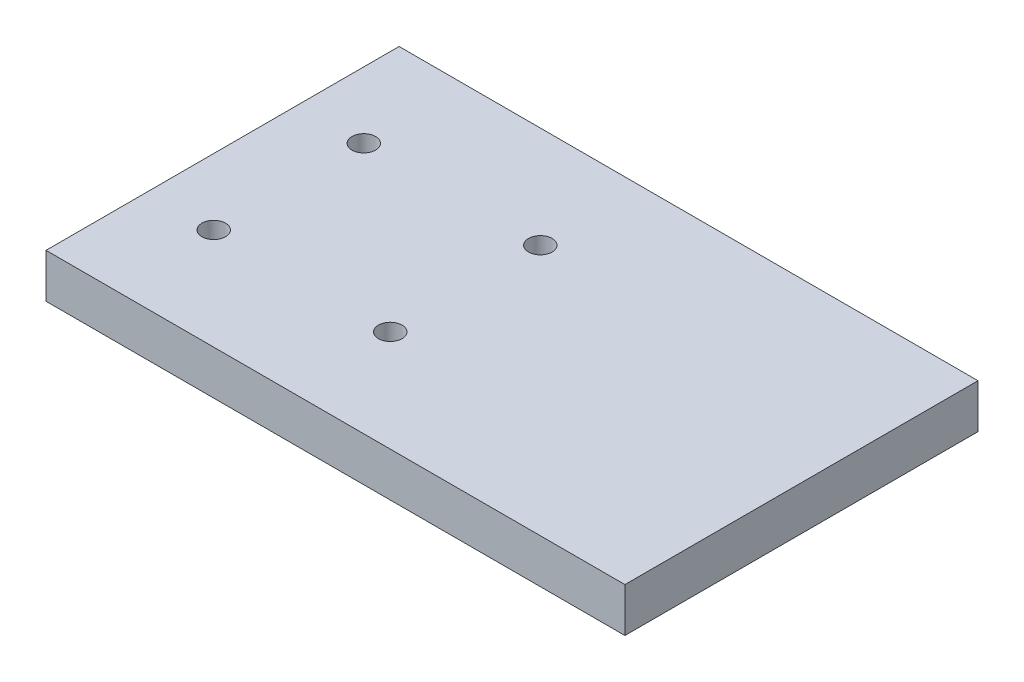
from build123d import *

# Parameters (mm, degrees)
SKETCH1_R           = 1.70053
BOSS_EXTRUDE1_DEPTH = 6.35


with BuildPart() as part:
    # Sketch1 → Boss-Extrude1 (new body)
    with BuildSketch(Plane(origin=(0, 0, 0), x_dir=(1, 0, 0), z_dir=(0, 1, 0))):
        Polygon((-25.233245497, -25.4), (-6.59007041, -25.4), (6.712481409, -25.4), (25.355656497, -25.4), (38.658208316, -25.4), (41.7070455, -25.4), (41.7070455, 25.4), (38.658208316, 25.4), (25.355656497, 25.4), (6.712481409, 25.4), (0.0612055, 25.4), (-6.59007041, 25.4), (-25.233245497, 25.4), (-38.535797316, 25.4), (-41.5846345, 25.4), (-41.5846345, -25.4), (-38.535797316, -25.4), align=None)
        with Locations(Location((-32.0583645, 10.795, 0), (0, 0, 270))):
            Circle(SKETCH1_R, mode=Mode.SUBTRACT)
        with Locations(Location((-32.0583645, -10.795, 0), (0, 0, 270))):
            Circle(SKETCH1_R, mode=Mode.SUBTRACT)
        with Locations(Location((-6.6583645, -10.795, 0), (0, 0, 270))):
            Circle(SKETCH1_R, mode=Mode.SUBTRACT)
        with Locations(Location((-6.6583645, 10.795, 0), (0, 0, 270))):
            Circle(SKETCH1_R, mode=Mode.SUBTRACT)
    extrude(amount=BOSS_EXTRUDE1_DEPTH)


solid = part.part
